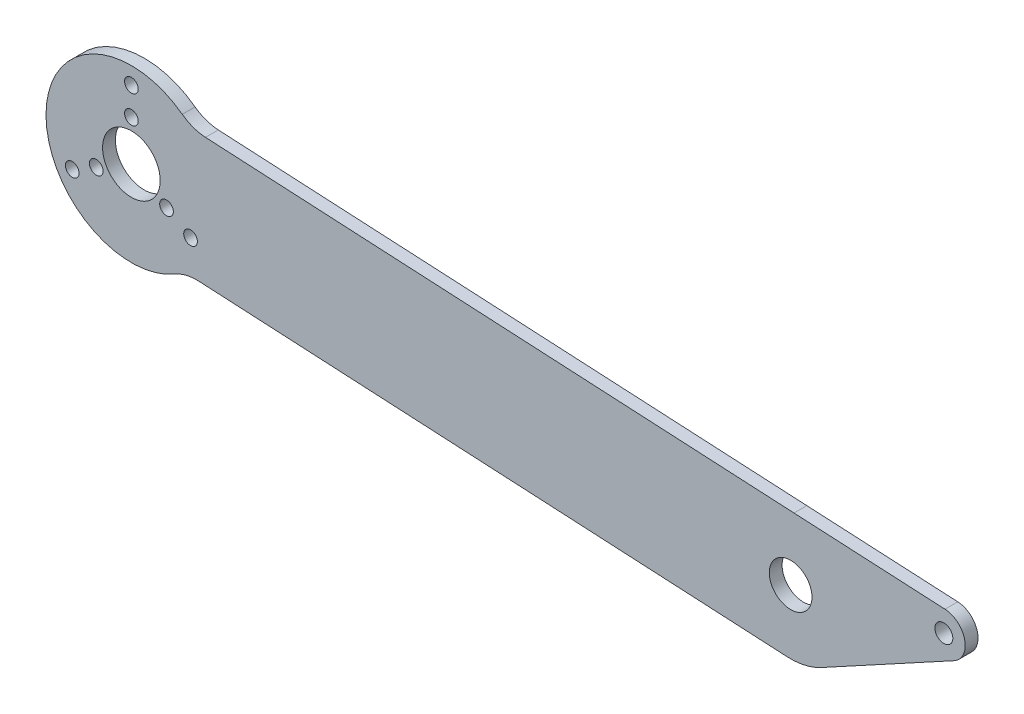
from build123d import *

# Parameters (mm, degrees)
SKETCH_1_R      = 5
SKETCH_1_R_2    = 2.1
SKETCH_1_R_3    = 6.75
SKETCH_1_R_4    = 1.6
EXTRUDE_1_DEPTH = 3
FILLET_1_R      = 10
FILLET_2_R      = 10


with BuildPart() as part:
    # 草图1 → 凸台-拉伸1 (new body)
    with BuildSketch(Plane.XY):
        with BuildLine():
            Line((12.419223494, -15.676826458), (153.603692908, -23.133474126))
            ThreePointArc((153.603692908, -23.133474126), (157.711237696, -22.783135564), (161.568286957, -21.32785817))
            Line((161.568286957, -21.32785817), (192.671157578, -4.391169028))
            ThreePointArc((192.671157578, -4.391169028), (195.155704471, 1.10792866), (190.538680801, 4.993303941))
            Line((190.538680801, 4.993303941), (155.185935535, 6.824771956))
            Line((155.185935535, 6.824771956), (14.001466121, 14.281419623))
            ThreePointArc((14.001466121, 14.281419623), (-19.972164054, 1.054828418), (12.419223494, -15.676826458))
        make_face()
        with Locations((154.394814221, -8.154351085)):
            Circle(SKETCH_1_R, mode=Mode.SUBTRACT)
        with Locations((190.28, 0)):
            Circle(SKETCH_1_R_2, mode=Mode.SUBTRACT)
        Circle(SKETCH_1_R_3, mode=Mode.SUBTRACT)
        with Locations((0, 9.5)):
            Circle(SKETCH_1_R_4, mode=Mode.SUBTRACT)
        with Locations((0, 16)):
            Circle(SKETCH_1_R_4, mode=Mode.SUBTRACT)
        with Locations((8.227241336, -4.75)):
            Circle(SKETCH_1_R_4, mode=Mode.SUBTRACT)
        with Locations((-8.227241336, -4.75)):
            Circle(SKETCH_1_R_4, mode=Mode.SUBTRACT)
        with Locations((13.856406461, -8)):
            Circle(SKETCH_1_R_4, mode=Mode.SUBTRACT)
        with Locations((-13.856406461, -8)):
            Circle(SKETCH_1_R_4, mode=Mode.SUBTRACT)
    extrude(amount=EXTRUDE_1_DEPTH)

    # 圆角1
    fillet_1_edges = [part.edges().sort_by_distance(p)[0] for p in [
        (14.001466121, 14.281419623, 1.5),
    ]]
    fillet(fillet_1_edges, radius=FILLET_1_R)

    # 圆角2
    fillet_2_edges = [part.edges().sort_by_distance(p)[0] for p in [
        (12.419223494, -15.676826458, 1.5),
    ]]
    fillet(fillet_2_edges, radius=FILLET_2_R)


solid = part.part
